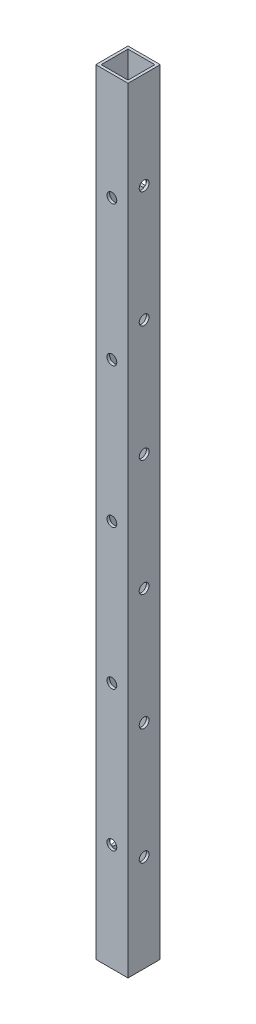
from build123d import *

# Parameters (mm, degrees)
SKETCH1_W                 = 19.05
SKETCH1_H                 = 19.05
SKETCH1_W_2               = 15.875
SKETCH1_H_2               = 15.875
TUBE_DEPTH                = 457.753199808
SKETCH2_R                 = 2.8956
TOPPLATEHOLES_DEPTH       = 459.24842614
LPATTERN1_COUNT           = 5
LPATTERN1_PITCH           = 82.739099952
SKETCH3_R                 = 2.8956
SIDEPLATEHOLEMASTER_DEPTH = 459.24842614
LPATTERN2_COUNT           = 6
LPATTERN2_PITCH           = 68.690639962


with BuildPart() as part:
    # Sketch1 → Tube (new body)
    with BuildSketch(Plane(origin=(0, 0, 0), x_dir=(1, 0, 0), z_dir=(0, 1, 0))):
        Rectangle(SKETCH1_W, SKETCH1_H)
        Rectangle(SKETCH1_W_2, SKETCH1_H_2, mode=Mode.SUBTRACT)
    extrude(amount=TUBE_DEPTH)

    # Sketch2 → TopPlateHoles (cut, through all)
    with BuildSketch(Plane.XY.offset(9.525)):
        with Locations((0, 394.354799808)):
            Circle(SKETCH2_R)
    topplateholes = extrude(amount=-TOPPLATEHOLES_DEPTH, mode=Mode.SUBTRACT)

    # LPattern1: TopPlateHoles ×5
    with Locations(*[(0, -i * LPATTERN1_PITCH, 0) for i in range(1, LPATTERN1_COUNT)]):
        add(topplateholes, mode=Mode.SUBTRACT)

    # Sketch3 → SidePlateHoleMaster (cut, through all)
    with BuildSketch(Plane.ZY.offset(9.525)):
        with Locations((0, 400.603199808)):
            Circle(SKETCH3_R)
    sideplateholemaster = extrude(amount=-SIDEPLATEHOLEMASTER_DEPTH, mode=Mode.SUBTRACT)

    # LPattern2: SidePlateHoleMaster ×6
    with Locations(*[(0, -i * LPATTERN2_PITCH, 0) for i in range(1, LPATTERN2_COUNT)]):
        add(sideplateholemaster, mode=Mode.SUBTRACT)


solid = part.part
